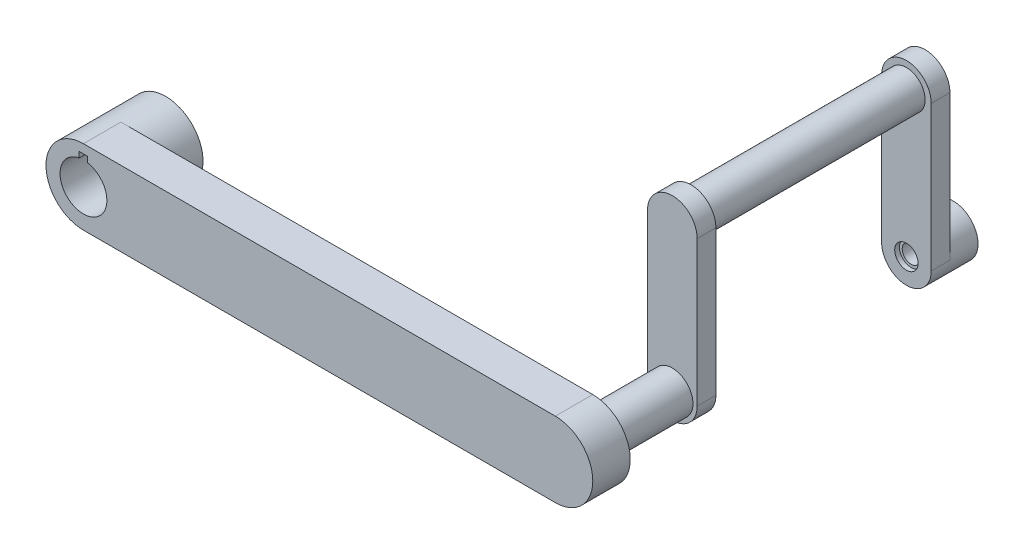
from build123d import *

# Parameters (mm, degrees)
SALIENTE_EXTRUIR1_DEPTH = 4
SALIENTE_EXTRUIR2_START = 4.77
CROQUIS2_R              = 4
SALIENTE_EXTRUIR2_DEPTH = 4.77
CROQUIS3_R              = 2.2
SALIENTE_EXTRUIR3_DEPTH = 8.5
SALIENTE_EXTRUIR4_DEPTH = 2
CROQUIS5_R              = 2
SALIENTE_EXTRUIR5_DEPTH = 23
CROQUIS6_R              = 0.95
SALIENTE_EXTRUIR6_DEPTH = 2
CROQUIS7_R              = 2.65
CROQUIS7_R_2            = 0.95
SALIENTE_EXTRUIR7_DEPTH = 3
CROQUIS8_R              = 1.25
CORTAR_EXTRUIR1_DEPTH   = 0.5


with BuildPart() as part:
    # Croquis1 → Saliente-Extruir1 (new body)
    with BuildSketch(Plane.XY):
        with BuildLine():
            Line((0, 4), (50.4, 4))
            ThreePointArc((50.4, 4), (54.4, 0), (50.4, -4))
            Line((50.4, -4), (0, -4))
            ThreePointArc((0, -4), (-4, 0), (0, 4))
        make_face()
        with BuildLine():
            Line((-0.45, 2.459166525), (-0.45, 3.059166525))
            Line((-0.45, 3.059166525), (0.45, 3.059166525))
            Line((0.45, 3.059166525), (0.45, 2.459166525))
            ThreePointArc((0.45, 2.459166525), (0, -2.5), (-0.45, 2.459166525))
        make_face(mode=Mode.SUBTRACT)
    extrude(amount=SALIENTE_EXTRUIR1_DEPTH)

    # Croquis2 → Saliente-Extruir2 (add)
    with BuildSketch(Plane(origin=(0, 0, 0), x_dir=(-1, 0, 0), z_dir=(0, 0, -1)).offset(SALIENTE_EXTRUIR2_START)):
        Circle(CROQUIS2_R)
        with BuildLine():
            Line((-0.45, 2.459166525), (-0.45, 3.059166525))
            Line((-0.45, 3.059166525), (0.45, 3.059166525))
            Line((0.45, 3.059166525), (0.45, 2.459166525))
            ThreePointArc((0.45, 2.459166525), (0, -2.5), (-0.45, 2.459166525))
        make_face(mode=Mode.SUBTRACT)
    extrude(amount=-SALIENTE_EXTRUIR2_DEPTH)

    # Croquis3 → Saliente-Extruir3 (add)
    with BuildSketch(Plane(origin=(0, 0, 0), x_dir=(-1, 0, 0), z_dir=(0, 0, -1))):
        with Locations(Location((-50.4, 0, 0), (0, 0, 180))):
            Circle(CROQUIS3_R)
    extrude(amount=SALIENTE_EXTRUIR3_DEPTH)

    # Croquis4 → Saliente-Extruir4 (add)
    with BuildSketch(Plane(origin=(0, 0, -8.5), x_dir=(-1, 0, 0), z_dir=(0, 0, -1))):
        with BuildLine():
            Line((-53.05, 15.5), (-53.05, 0))
            ThreePointArc((-53.05, 0), (-50.4, -2.65), (-47.75, 0))
            Line((-47.75, 0), (-47.75, 15.5))
            ThreePointArc((-47.75, 15.5), (-50.4, 18.15), (-53.05, 15.5))
        make_face()
    extrude(amount=SALIENTE_EXTRUIR4_DEPTH)

    # Croquis5 → Saliente-Extruir5 (add)
    with BuildSketch(Plane(origin=(0, 0, -10.5), x_dir=(-1, 0, 0), z_dir=(0, 0, -1))):
        with Locations((-50.4, 15.5)):
            Circle(CROQUIS5_R)
    extrude(amount=SALIENTE_EXTRUIR5_DEPTH)

    # Croquis6 → Saliente-Extruir6 (add)
    with BuildSketch(Plane(origin=(0, 0, -33.5), x_dir=(-1, 0, 0), z_dir=(0, 0, -1))):
        with BuildLine():
            Line((-53.05, 15.5), (-53.05, 0))
            ThreePointArc((-53.05, 0), (-50.4, -2.65), (-47.75, 0))
            Line((-47.75, 0), (-47.75, 15.5))
            ThreePointArc((-47.75, 15.5), (-50.4, 18.15), (-53.05, 15.5))
        make_face()
        with Locations((-50.4, 0)):
            Circle(CROQUIS6_R, mode=Mode.SUBTRACT)
    extrude(amount=SALIENTE_EXTRUIR6_DEPTH)

    # Croquis7 → Saliente-Extruir7 (add)
    with BuildSketch(Plane(origin=(0, 0, -35.5), x_dir=(-1, 0, 0), z_dir=(0, 0, -1))):
        with Locations((-50.4, 0)):
            Circle(CROQUIS7_R)
        with Locations((-50.4, 0)):
            Circle(CROQUIS7_R_2, mode=Mode.SUBTRACT)
    extrude(amount=SALIENTE_EXTRUIR7_DEPTH)

    # Croquis8 → Cortar-Extruir1 (cut)
    with BuildSketch(Plane.XY.offset(-33.5)):
        with Locations((50.4, 0)):
            Circle(CROQUIS8_R)
    extrude(amount=-CORTAR_EXTRUIR1_DEPTH, mode=Mode.SUBTRACT)


solid = part.part
